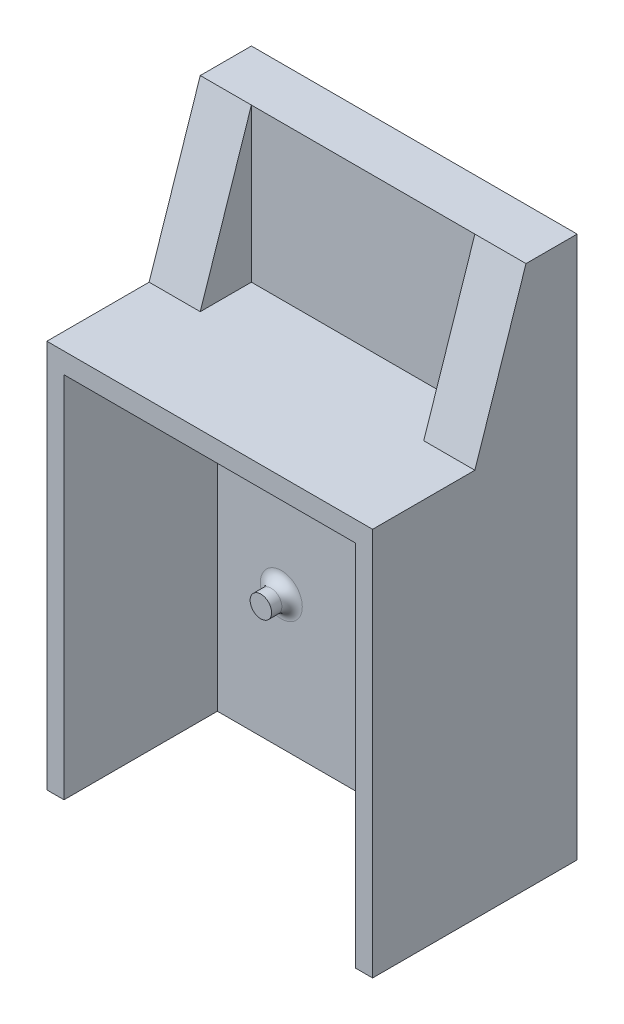
from build123d import *

# Parameters (mm, degrees)
SKETCH_1_W      = 31.852941176
SKETCH_1_H      = 38
EXTRUDE_1_DEPTH = 5
EXTRUDE_2_DEPTH = 15
SKETCH_3_R      = 1.05
EXTRUDE_3_DEPTH = 2
SKETCH_4_W      = 31.852941176
SKETCH_4_H      = 15
EXTRUDE_4_DEPTH = 5
EXTRUDE_5_DEPTH = 5
EXTRUDE_6_DEPTH = 5
FILLET_1_R      = 1


with BuildPart() as part:
    # 草图1 → 凸台-拉伸1 (new body)
    with BuildSketch(Plane.XY):
        Rectangle(SKETCH_1_W, SKETCH_1_H)
    extrude(amount=EXTRUDE_1_DEPTH)

    # 草图2 → 凸台-拉伸2 (add)
    with BuildSketch(Plane.XY.offset(5)):
        Polygon((-14.25, -19), (-14.25, -17), (-14.25, 17), (14.25, 17), (14.25, -17), (14.25, -19), (15.926470588, -19), (15.926470588, 19), (-15.926470588, 19), (-15.926470588, -19), align=None)
    extrude(amount=EXTRUDE_2_DEPTH)

    # 草图3 → 凸台-拉伸3 (add)
    with BuildSketch(Plane.XY.offset(5)):
        with Locations((-8, 6)):
            Circle(SKETCH_3_R)
        with Locations((8, 6)):
            Circle(SKETCH_3_R)
        with Locations((-8, -6)):
            Circle(SKETCH_3_R)
        with Locations((8, -6)):
            Circle(SKETCH_3_R)
    extrude(amount=EXTRUDE_3_DEPTH)

    # 草图4 → 凸台-拉伸4 (add)
    with BuildSketch(Plane(origin=(0, 0, 0), x_dir=(-1, 0, 0), z_dir=(0, 0, -1))):
        with Locations((0, 26.5)):
            Rectangle(SKETCH_4_W, SKETCH_4_H)
    extrude(amount=-EXTRUDE_4_DEPTH)

    # 草图5 → 凸台-拉伸5 (add)
    with BuildSketch(Plane.ZY.offset(15.926470588)):
        Polygon((5, 34), (10, 19), (5, 19), align=None)
    extrude(amount=-EXTRUDE_5_DEPTH)

    # 草图6 → 凸台-拉伸6 (add)
    with BuildSketch(Plane(origin=(15.926470588, 0, 0), x_dir=(0, 0, -1), z_dir=(1, 0, 0))):
        Polygon((-5, 19), (-5, 34), (-10, 19), align=None)
    extrude(amount=-EXTRUDE_6_DEPTH)

    # 圆角1
    fillet_1_edges = [part.edges().sort_by_distance(p)[0] for p in [
        (-9.05, 6, 5),
        (6.95, 6, 5),
        (-9.05, -6, 5),
        (6.95, -6, 5),
    ]]
    fillet(fillet_1_edges, radius=FILLET_1_R)


solid = part.part
